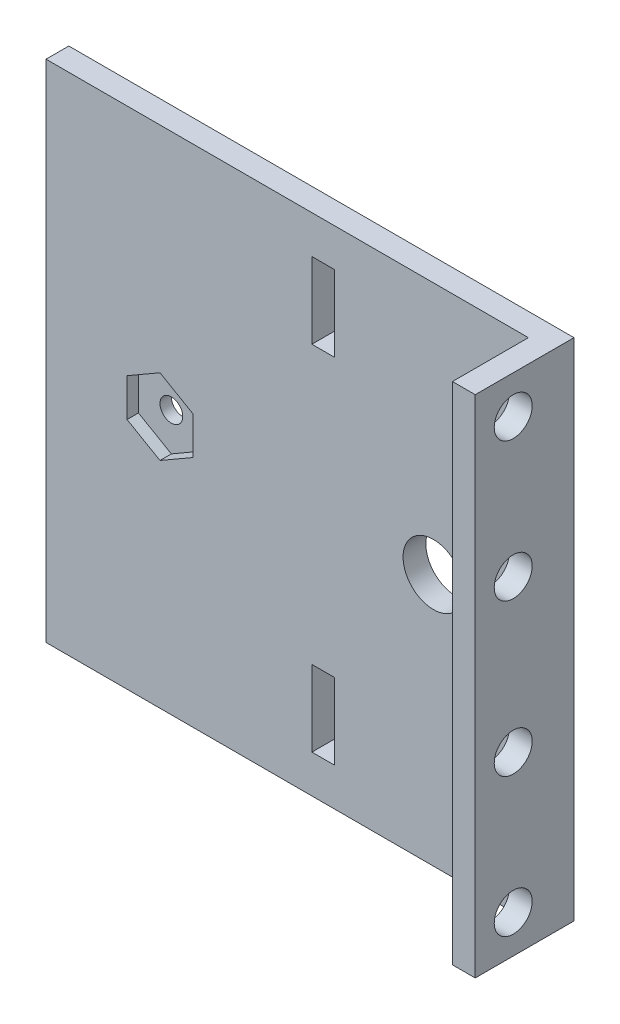
from build123d import *

# Parameters (mm, degrees)
SKETCH1_W           = 66.5
SKETCH1_H           = 66.5
SKETCH1_R           = 4
BOSS_EXTRUDE1_DEPTH = 3
SKETCH3_W           = 3
SKETCH3_H           = 66.5
BOSS_EXTRUDE2_DEPTH = 10
CUT_EXTRUDE1_REACH  = 77.477
SKETCH5_R           = 2.5
CUT_EXTRUDE2_REACH  = 50.787
SKETCH6_W           = 3
SKETCH6_H           = 10
CUT_EXTRUDE5_DEPTH  = 1.5
CUT_EXTRUDE6_REACH  = 50.787
SKETCH9_R           = 1.5


with BuildPart() as part:
    # Sketch1 → Boss-Extrude1 (new body)
    with BuildSketch(Plane.XY):
        Rectangle(SKETCH1_W, SKETCH1_H)
        with Locations((17.75, 0)):
            Circle(SKETCH1_R, mode=Mode.SUBTRACT)
    extrude(amount=BOSS_EXTRUDE1_DEPTH)

    # Sketch3 → Boss-Extrude2 (add)
    with BuildSketch(Plane.XY.offset(3)):
        with Locations((31.75, 0)):
            Rectangle(SKETCH3_W, SKETCH3_H)
    extrude(amount=BOSS_EXTRUDE2_DEPTH)

    # Sketch5 → Cut-Extrude1 (cut, up to next)
    with BuildSketch(Plane(origin=(33.25, 0, 0), x_dir=(0, 0, -1), z_dir=(1, 0, 0)), mode=Mode.PRIVATE) as cut_extrude1_sk1:
        with Locations(Location((-8, -28.25, 0), (0, 0, 90))):
            Circle(SKETCH5_R)
    cut_extrude1_tool1 = extrude(cut_extrude1_sk1.sketch, amount=-CUT_EXTRUDE1_REACH, mode=Mode.PRIVATE) & part.part
    # Sketch5 → Cut-Extrude1 (cut, up to next)
    with BuildSketch(Plane(origin=(33.25, 0, 0), x_dir=(0, 0, -1), z_dir=(1, 0, 0)), mode=Mode.PRIVATE) as cut_extrude1_sk2:
        with Locations(Location((-8, -10, 0), (0, 0, 90))):
            Circle(SKETCH5_R)
    cut_extrude1_tool2 = extrude(cut_extrude1_sk2.sketch, amount=-CUT_EXTRUDE1_REACH, mode=Mode.PRIVATE) & part.part
    cut_extrude1_1 = cut_extrude1_tool1.solids().sort_by_distance((33.25, -28.25, 8))[0]
    add(cut_extrude1_1, mode=Mode.SUBTRACT)
    cut_extrude1_2 = cut_extrude1_tool2.solids().sort_by_distance((33.25, -10, 8))[0]
    add(cut_extrude1_2, mode=Mode.SUBTRACT)
    cut_extrude1 = cut_extrude1_1 + cut_extrude1_2  # Cut-Extrude1 as one shape, for the pattern or mirror that repeats it

    # Mirror2: Cut-Extrude1 across plane
    add(cut_extrude1.mirror(Plane.ZX), mode=Mode.SUBTRACT)

    # Sketch6 → Cut-Extrude2 (cut, up to next)
    with BuildSketch(Plane(origin=(0, 0, 0), x_dir=(-1, 0, 0), z_dir=(0, 0, -1)), mode=Mode.PRIVATE) as cut_extrude2_sk1:
        with Locations((-3.25, 23.25)):
            Rectangle(SKETCH6_W, SKETCH6_H)
    cut_extrude2_tool1 = extrude(cut_extrude2_sk1.sketch, amount=-CUT_EXTRUDE2_REACH, mode=Mode.PRIVATE) & part.part
    cut_extrude2 = cut_extrude2_tool1.solids().sort_by_distance((3.25, 23.25, 0))[0]
    add(cut_extrude2, mode=Mode.SUBTRACT)

    # Mirror3: Cut-Extrude2 across plane
    add(cut_extrude2.mirror(Plane.ZX), mode=Mode.SUBTRACT)

    # Sketch7 → Cut-Extrude5 (cut)
    with BuildSketch(Plane(origin=(0, 0, 3), x_dir=(-1, 0, 0), z_dir=(0, 0, -1))):
        Polygon((18.25, -5), (22.580127019, -2.5), (22.580127019, 2.5), (18.25, 5), (13.919872981, 2.5), (13.919872981, -2.5), align=None)
    extrude(amount=CUT_EXTRUDE5_DEPTH, mode=Mode.SUBTRACT)

    # Sketch9 → Cut-Extrude6 (cut, up to next)
    with BuildSketch(Plane(origin=(0, 0, 0), x_dir=(-1, 0, 0), z_dir=(0, 0, -1)), mode=Mode.PRIVATE) as cut_extrude6_sk1:
        with Locations((18.25, 0)):
            Circle(SKETCH9_R)
    cut_extrude6_tool1 = extrude(cut_extrude6_sk1.sketch, amount=-CUT_EXTRUDE6_REACH, mode=Mode.PRIVATE) & part.part
    add(cut_extrude6_tool1.solids().sort_by_distance((-18.25, 0, 0))[0], mode=Mode.SUBTRACT)


solid = part.part
